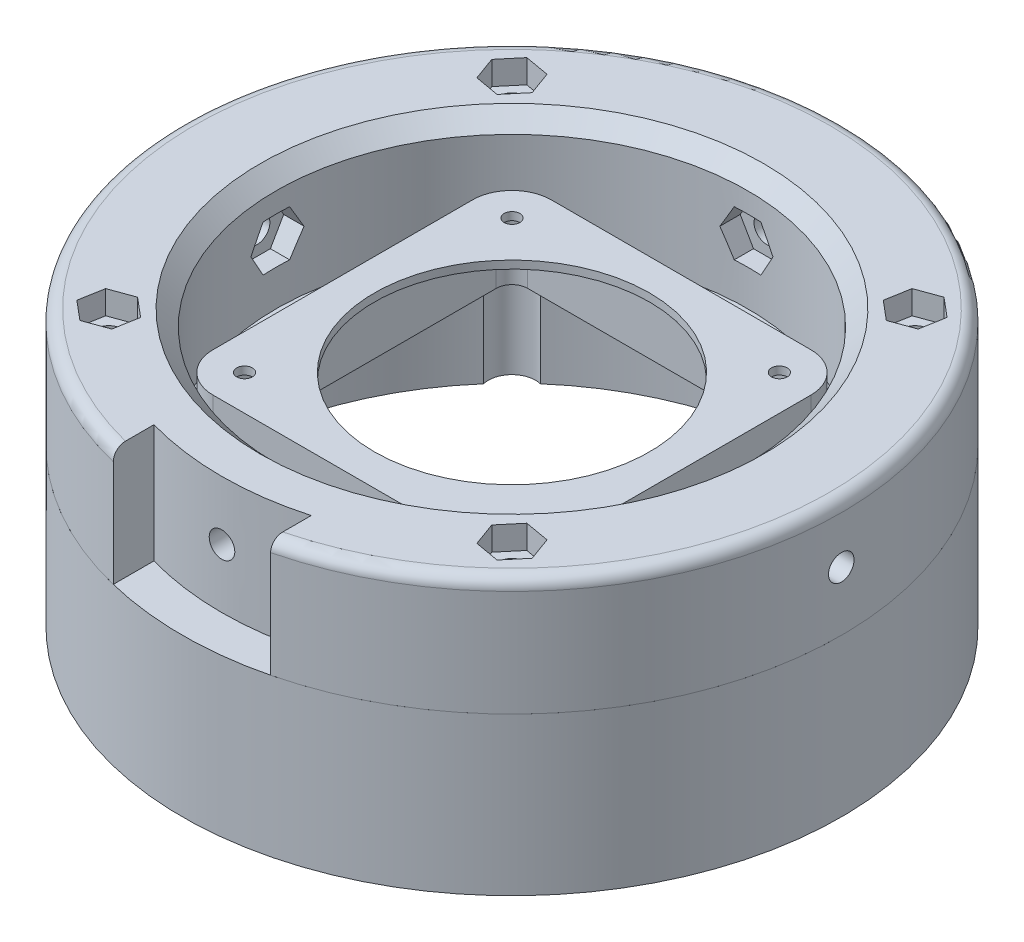
from build123d import *

# Parameters (mm, degrees)
SKETCH1_R               = 41.9
TOP_PART_DEPTH          = 15
SKETCH2_R               = 30
CUT_EXTRUDE1_DEPTH      = 20
FILLET1_R               = 1.5
CHAMFER1_SIZE           = 2
SKETCH8_7_R             = 1.625
CUT_EXTRUDE8_DEPTH      = 3
SKETCH8_R               = 1.625
CUT_EXTRUDE7_DEPTH      = 62.124626857
CUT_EXTRUDE11_DEPTH     = 62.124626881
SKETCH15_R              = 1.625
CUT_EXTRUDE14_DEPTH     = 10
CUT_EXTRUDE15_DEPTH     = 10
CIRPATTERN1_COUNT       = 4
CIRPATTERN2_COUNT       = 4
SKETCH3_R               = 41.9
BOTTOM_PART_DEPTH       = 20
SKETCH6_R               = 37.9
CUT_EXTRUDE3_DEPTH      = 63.076324134
SKETCH_1_W              = 43
SKETCH_1_H              = 43
EXTRUDE_1_DEPTH         = 8
FILLET_1_R              = 5
CUT_EXTRUDE4_DEPTH      = 63.076324134
CUT_EXTRUDE4_DEPTH_BACK = 63.076324134
SKETCH7_R               = 17.5
SKETCH7_R_2             = 1
SKETCH12_W              = 39.5
SKETCH12_H              = 39.5
CUT_EXTRUDE10_DEPTH     = 8.5
FILLET3_R               = 2
SKETCH17_R              = 1.625
CUT_EXTRUDE16_DEPTH     = 63.076324134
SKETCH18_R              = 3
CUT_EXTRUDE17_DEPTH     = 63.076324134


with BuildPart() as part:
    # Sketch1 → Top-Part (new body)
    with BuildSketch(Plane(origin=(0, 0, 0), x_dir=(1, 0, 0), z_dir=(0, 1, 0))):
        Circle(SKETCH1_R)
    extrude(amount=TOP_PART_DEPTH)

    # Sketch2 → Cut-Extrude1 (cut)
    with BuildSketch(Plane(origin=(0, 15, 0), x_dir=(1, 0, 0), z_dir=(0, 1, 0))):
        Circle(SKETCH2_R)
    extrude(amount=-CUT_EXTRUDE1_DEPTH, mode=Mode.SUBTRACT)

    # Fillet1
    fillet1_edges = [part.edges().sort_by_distance(p)[0] for p in [
        (-41.9, 15, 0),
    ]]
    fillet(fillet1_edges, radius=FILLET1_R)

    # Chamfer1
    chamfer1_edges = [part.edges().sort_by_distance(p)[0] for p in [
        (-30, 15, 0),
    ]]
    chamfer(chamfer1_edges, length=CHAMFER1_SIZE)

    # Sketch8<7> → Cut-Extrude8 (cut)
    # profile 1 of 4: a face of its own
    with BuildSketch(Plane(origin=(0, 15, 0), x_dir=(1, 0, 0), z_dir=(0, 1, 0))):
        Polygon((25.083213555, 22.516777398), (28.056316743, 23.598898462), (28.605724005, 26.714741882), (26.182028081, 28.748464238), (23.208924893, 27.666343174), (22.659517631, 24.550499754), align=None)
        with Locations((25.632620818, 25.632620818)):
            Circle(SKETCH8_7_R, mode=Mode.SUBTRACT)
    # profile 2 of 4: a face of its own
    with BuildSketch(Plane(origin=(0, 15, 0), x_dir=(1, 0, 0), z_dir=(0, 1, 0))):
        Polygon((-22.516777398, 25.083213555), (-23.598898462, 28.056316743), (-26.714741882, 28.605724005), (-28.748464238, 26.182028081), (-27.666343174, 23.208924893), (-24.550499754, 22.659517631), align=None)
        with Locations((-25.632620818, 25.632620818)):
            Circle(SKETCH8_7_R, mode=Mode.SUBTRACT)
    # profile 3 of 4: a face of its own
    with BuildSketch(Plane(origin=(0, 15, 0), x_dir=(1, 0, 0), z_dir=(0, 1, 0))):
        Polygon((22.516777398, -25.083213555), (23.598898462, -28.056316743), (26.714741882, -28.605724005), (28.748464238, -26.182028081), (27.666343174, -23.208924893), (24.550499754, -22.659517631), align=None)
        with Locations((25.632620818, -25.632620818)):
            Circle(SKETCH8_7_R, mode=Mode.SUBTRACT)
    # profile 4 of 4: a face of its own
    with BuildSketch(Plane(origin=(0, 15, 0), x_dir=(1, 0, 0), z_dir=(0, 1, 0))):
        Polygon((-25.083213555, -22.516777398), (-28.056316743, -23.598898462), (-28.605724005, -26.714741882), (-26.182028081, -28.748464238), (-23.208924893, -27.666343174), (-22.659517631, -24.550499754), align=None)
        with Locations((-25.632620818, -25.632620818)):
            Circle(SKETCH8_7_R, mode=Mode.SUBTRACT)
    extrude(amount=-CUT_EXTRUDE8_DEPTH, mode=Mode.SUBTRACT)

    # Sketch8 → Cut-Extrude7 (cut, through all)
    with BuildSketch(Plane(origin=(0, 15, 0), x_dir=(1, 0, 0), z_dir=(0, 1, 0))):
        with Locations((-25.632620818, 25.632620818)):
            Circle(SKETCH8_R)
        with Locations((25.632620818, 25.632620818)):
            Circle(SKETCH8_R)
        with Locations((25.632620818, -25.632620818)):
            Circle(SKETCH8_R)
        with Locations((-25.632620818, -25.632620818)):
            Circle(SKETCH8_R)
    extrude(amount=-CUT_EXTRUDE7_DEPTH, mode=Mode.SUBTRACT)

    # Sketch13 → Cut-Extrude11 (cut, through all)
    with BuildSketch(Plane.XZ):
        with BuildLine():
            Line((-10, 35.519149765), (-10, 40.689187753))
            ThreePointArc((-10, 40.689187753), (0, 41.9), (10, 40.689187753))
            Line((10, 40.689187753), (10, 35.519149765))
            ThreePointArc((10, 35.519149765), (0, 36.9), (-10, 35.519149765))
        make_face()
    extrude(amount=-CUT_EXTRUDE11_DEPTH, mode=Mode.SUBTRACT)

    # Sketch15 → Cut-Extrude14 (cut, symmetric)
    with BuildSketch(Plane.XY.offset(32.4)):
        with Locations((0, 7.5)):
            Circle(SKETCH15_R)
    cut_extrude14 = extrude(amount=CUT_EXTRUDE14_DEPTH, both=True, mode=Mode.SUBTRACT)

    # Sketch16 → Cut-Extrude15 (cut)
    with BuildSketch(Plane.XY.offset(32.4)):
        Polygon((3.377499075, 7.5), (1.688749537, 10.425), (-1.688749537, 10.425), (-3.377499075, 7.5), (-1.688749537, 4.575), (1.688749537, 4.575), align=None)
    cut_extrude15 = extrude(amount=-CUT_EXTRUDE15_DEPTH, mode=Mode.SUBTRACT)

    # CirPattern1: Cut-Extrude14 ×4 about axis
    cirpattern1_axis = Axis((0, 0, 0), (0, 1, 0))
    for i in range(1, CIRPATTERN1_COUNT):
        add(cut_extrude14.rotate(cirpattern1_axis, i * 360 / CIRPATTERN1_COUNT), mode=Mode.SUBTRACT)

    # CirPattern2: Cut-Extrude15 ×4 about axis
    cirpattern2_axis = Axis((0, 0, 0), (0, 1, 0))
    for i in range(1, CIRPATTERN2_COUNT):
        add(cut_extrude15.rotate(cirpattern2_axis, i * 360 / CIRPATTERN2_COUNT), mode=Mode.SUBTRACT)


with BuildPart() as body_2:
    # Sketch3 → Bottom-Part (new body)
    with BuildSketch(Plane.XZ):
        Circle(SKETCH3_R)
    extrude(amount=BOTTOM_PART_DEPTH)

    # Sketch6 → Cut-Extrude3 (cut, through all)
    with BuildSketch(Plane(origin=(0, -1.5, 0), x_dir=(1, 0, 0), z_dir=(0, 1, 0))):
        Circle(SKETCH6_R)
    extrude(amount=-CUT_EXTRUDE3_DEPTH, mode=Mode.SUBTRACT)

    # ｽｹｯﾁ1 → ﾎﾞｽ - 押し出し1 (add)
    with BuildSketch(Plane(origin=(0, 0, 0), x_dir=(1, 0, 0), z_dir=(0, 1, 0))):
        Rectangle(SKETCH_1_W, SKETCH_1_H)
    extrude(amount=EXTRUDE_1_DEPTH)

    # ﾌｨﾚｯﾄ1
    fillet_1_edges = [body_2.edges().sort_by_distance(p)[0] for p in [
        (21.5, 4, -21.5),
        (-21.5, 4, -21.5),
        (-21.5, 4, 21.5),
        (21.5, 4, 21.5),
    ]]
    fillet(fillet_1_edges, radius=FILLET_1_R)

    # Sketch7 → Cut-Extrude4 (cut, two sides: drawn at the far end of the back side and taken through both)
    with BuildSketch(Plane(origin=(0, -1.5, 0), x_dir=(1, 0, 0), z_dir=(0, 1, 0)).offset(-CUT_EXTRUDE4_DEPTH_BACK)):
        Circle(SKETCH7_R)
        with Locations((17, -17)):
            Circle(SKETCH7_R_2)
        with Locations((-17, -17)):
            Circle(SKETCH7_R_2)
        with Locations((-17, 17)):
            Circle(SKETCH7_R_2)
        with Locations((17, 17)):
            Circle(SKETCH7_R_2)
    extrude(amount=CUT_EXTRUDE4_DEPTH + CUT_EXTRUDE4_DEPTH_BACK, mode=Mode.SUBTRACT)

    # Sketch12 → Cut-Extrude10 (cut)
    with BuildSketch(Plane.XZ.offset(1.5)):
        Rectangle(SKETCH12_W, SKETCH12_H)
    extrude(amount=-CUT_EXTRUDE10_DEPTH, mode=Mode.SUBTRACT)

    # Fillet3
    fillet3_edges = [body_2.edges().sort_by_distance(p)[0] for p in [
        (-19.75, 2.75, -19.75),
        (-19.75, 2.75, 19.75),
        (19.75, 2.75, -19.75),
        (19.75, 2.75, 19.75),
    ]]
    fillet(fillet3_edges, radius=FILLET3_R)

    # Sketch17 → Cut-Extrude16 (cut, through all)
    with BuildSketch(Plane.XZ.offset(1.5)):
        with Locations((25.632620818, -25.632620818)):
            Circle(SKETCH17_R)
        with Locations((-25.632620818, -25.632620818)):
            Circle(SKETCH17_R)
        with Locations((25.632620818, 25.632620818)):
            Circle(SKETCH17_R)
        with Locations((-25.632620818, 25.632620818)):
            Circle(SKETCH17_R)
    extrude(amount=-CUT_EXTRUDE16_DEPTH, mode=Mode.SUBTRACT)

    # Sketch18 → Cut-Extrude17 (cut, through all)
    with BuildSketch(Plane.XZ.offset(1.5)):
        with Locations((-25.632620818, 25.632620818)):
            Circle(SKETCH18_R)
        with Locations((25.632620818, 25.632620818)):
            Circle(SKETCH18_R)
        with Locations((25.632620818, -25.632620818)):
            Circle(SKETCH18_R)
        with Locations((-25.632620818, -25.632620818)):
            Circle(SKETCH18_R)
    extrude(amount=CUT_EXTRUDE17_DEPTH, mode=Mode.SUBTRACT)


solid = Compound([part.part, body_2.part])
